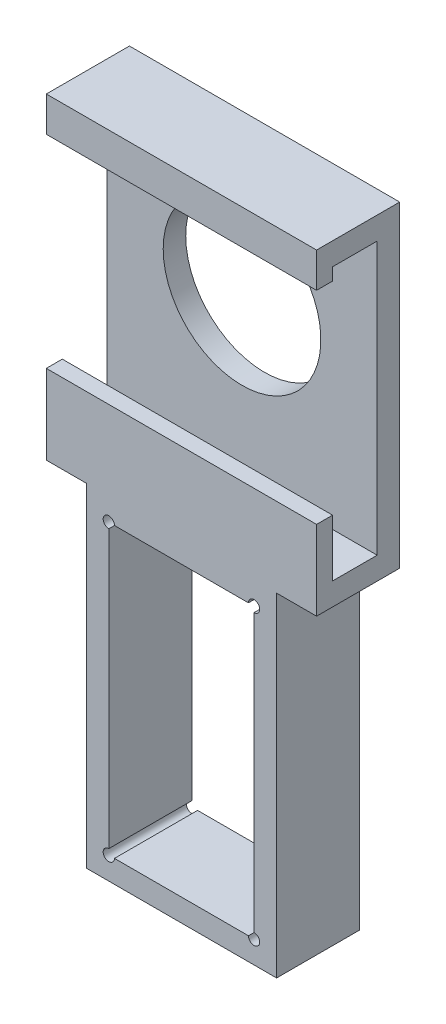
from build123d import *

# Parameters (mm, degrees)
BOSS_EXTRUDE1_DEPTH                               = 2
BOSS_EXTRUDE1_DEPTH_BACK                          = 2
SKETCH1_W                                         = 48
SKETCH1_H                                         = 56.32
BOSS_EXTRUDE2_DEPTH                               = 48
SKETCH4_R                                         = 14
CUT_EXTRUDE1_DEPTH                                = 43.726478909
CSK_FOR_8_FLAT_HEAD_MACHINE_SCREW_100_D           = 4.4958
CSK_FOR_8_FLAT_HEAD_MACHINE_SCREW_100_DEPTH       = 8
CSK_FOR_8_FLAT_HEAD_MACHINE_SCREW_100_CSINK_D     = 8.4328
CSK_FOR_8_FLAT_HEAD_MACHINE_SCREW_100_CSINK_ANGLE = 100
CSK_FOR_8_FLAT_HEAD_MACHINE_SCREW_100_TIP         = 1.350674586
SKETCH13_W                                        = 33.8
SKETCH13_H                                        = 59.2
SKETCH13_W_2                                      = 25.8
SKETCH13_H_2                                      = 51.2
BOSS_EXTRUDE4_DEPTH                               = 14.76
SKETCH14_R                                        = 1
CUT_EXTRUDE5_DEPTH                                = 96.567776996


with BuildPart() as part:
    # Sketch1 → Boss-Extrude1 (new, two sides: drawn at the far end of the back side and taken through both)
    with BuildSketch(Plane.XY.offset(-BOSS_EXTRUDE1_DEPTH_BACK)):
        with Locations((0, -3.96)):
            Rectangle(SKETCH1_W, SKETCH1_H)
    extrude(amount=BOSS_EXTRUDE1_DEPTH + BOSS_EXTRUDE1_DEPTH_BACK)

    # Sketch3 → Boss-Extrude2 (add)
    with BuildSketch(Plane.ZY.offset(24)):
        Polygon((2, 24.2), (12.76, 24.2), (12.76, 18), (9.92, 18), (9.92, 20.2), (2, 20.2), align=None)
        Polygon((12.76, -18), (9.92, -18), (9.92, -28.12), (2, -28.12), (2, -32.12), (12.76, -32.12), align=None)
    extrude(amount=-BOSS_EXTRUDE2_DEPTH)

    # Sketch4 → Cut-Extrude1 (cut, through all)
    with BuildSketch(Plane(origin=(0, 0, -2), x_dir=(-1, 0, 0), z_dir=(0, 0, -1))):
        Circle(SKETCH4_R)
    extrude(amount=-CUT_EXTRUDE1_DEPTH, mode=Mode.SUBTRACT)

    # CSK for #8 Flat Head Machine Screw (100)1
    with Locations(Plane(origin=(0, -32.12, 0), x_dir=(-1, 0, 0), z_dir=(0, -1, 0))):
        with Locations((0, -5.38)):
            CounterSinkHole(CSK_FOR_8_FLAT_HEAD_MACHINE_SCREW_100_D / 2, CSK_FOR_8_FLAT_HEAD_MACHINE_SCREW_100_CSINK_D / 2, depth=CSK_FOR_8_FLAT_HEAD_MACHINE_SCREW_100_DEPTH, counter_sink_angle=CSK_FOR_8_FLAT_HEAD_MACHINE_SCREW_100_CSINK_ANGLE)
            with Locations((0, 0, -(CSK_FOR_8_FLAT_HEAD_MACHINE_SCREW_100_DEPTH + CSK_FOR_8_FLAT_HEAD_MACHINE_SCREW_100_TIP / 2))):  # 118° drill point
                Cone(0, CSK_FOR_8_FLAT_HEAD_MACHINE_SCREW_100_D / 2, CSK_FOR_8_FLAT_HEAD_MACHINE_SCREW_100_TIP, mode=Mode.SUBTRACT)

    # Sketch13 → Boss-Extrude4 (add)
    with BuildSketch(Plane.XY.offset(12.76)):
        with Locations((0, -61.72)):
            Rectangle(SKETCH13_W, SKETCH13_H)
        with Locations((0, -61.72)):
            Rectangle(SKETCH13_W_2, SKETCH13_H_2, mode=Mode.SUBTRACT)
    extrude(amount=-BOSS_EXTRUDE4_DEPTH)

    # Sketch14 → Cut-Extrude5 (cut, through all)
    with BuildSketch(Plane.XY.offset(12.76)):
        with Locations((-12.9, -36.12)):
            Circle(SKETCH14_R)
        with Locations((12.9, -36.12)):
            Circle(SKETCH14_R)
        with Locations((12.9, -87.32)):
            Circle(SKETCH14_R)
        with Locations((-12.9, -87.32)):
            Circle(SKETCH14_R)
    extrude(amount=-CUT_EXTRUDE5_DEPTH, mode=Mode.SUBTRACT)


solid = part.part
